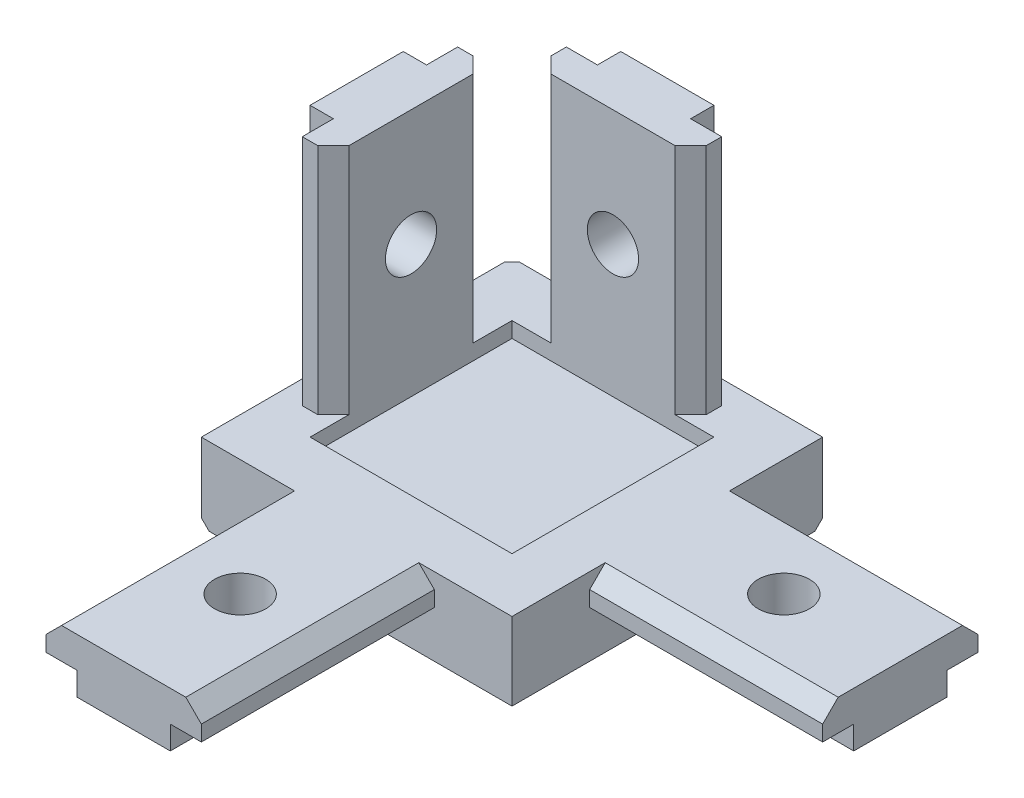
from build123d import *

# Parameters (mm, degrees)
SKETCH_1_W          = 20
SKETCH_1_H          = 20
EXTRUDE_1_DEPTH     = 5
EXTRUDE_3_DEPTH     = 15
EXTRUDE_4_DEPTH     = 15
EXTRUDE_5_DEPTH     = 15
SKETCH_9_W          = 13
SKETCH_9_H          = 13
CUT_EXTRUDE_4_DEPTH = 1
HOLE_WIZARD_M4_1_D  = 3.3
HOLE_WIZARD_M4_2_D  = 3.3
HOLE_WIZARD_M4_3_D  = 3.3
CHAMFER_1_SIZE      = 0.5


with BuildPart() as part:
    # 草图1 → 凸台-拉伸1 (new body)
    with BuildSketch(Plane(origin=(0, 0, 0), x_dir=(1, 0, 0), z_dir=(0, 1, 0))):
        Rectangle(SKETCH_1_W, SKETCH_1_H)
    extrude(amount=EXTRUDE_1_DEPTH)

    # 草图6 → 凸台-拉伸3 (add)
    with BuildSketch(Plane(origin=(10, 0, 0), x_dir=(0, 0, -1), z_dir=(1, 0, 0))):
        Polygon((-3, 1.5), (-3, 3), (-5, 3), (-5, 4), (-4, 5), (4, 5), (5, 4), (5, 3), (3, 3), (3, 1.5), align=None)
    extrude(amount=EXTRUDE_3_DEPTH)

    # 草图7 → 凸台-拉伸4 (add)
    with BuildSketch(Plane.XY.offset(10)):
        Polygon((-3, 1.5), (-3, 3), (-5, 3), (-5, 4), (-4, 5), (4, 5), (5, 4), (5, 3), (3, 3), (3, 1.5), align=None)
    extrude(amount=EXTRUDE_4_DEPTH)

    # 草图8 → 凸台-拉伸5 (add)
    with BuildSketch(Plane(origin=(0, 5, 0), x_dir=(1, 0, 0), z_dir=(0, 1, 0))):
        Polygon((-10, 3), (-8.5, 3), (-8.5, 5), (-7.5, 5), (-6.5, 4), (-6.5, -4), (-7.5, -5), (-8.5, -5), (-8.5, -3), (-10, -3), align=None)
        Polygon((3, 10), (-3, 10), (-3, 8.5), (-5, 8.5), (-5, 7.5), (-4, 6.5), (4, 6.5), (5, 7.5), (5, 8.5), (3, 8.5), align=None)
    extrude(amount=EXTRUDE_5_DEPTH)

    # 草图9 → 切除-拉伸4 (cut)
    with BuildSketch(Plane(origin=(0, 5, 0), x_dir=(1, 0, 0), z_dir=(0, 1, 0))):
        Rectangle(SKETCH_9_W, SKETCH_9_H)
    extrude(amount=-CUT_EXTRUDE_4_DEPTH, mode=Mode.SUBTRACT)

    # M4 螺纹孔1 (through all)
    with Locations(Plane(origin=(0, 5, 0), x_dir=(1, 0, 0), z_dir=(0, 1, 0))):
        with Locations((0, -17.5), (17.5, 0)):
            Hole(HOLE_WIZARD_M4_1_D / 2)

    # M4 螺纹孔2 (through all)
    with Locations(Plane.XY.offset(-6.5)):
        with Locations((0, 12.5)):
            Hole(HOLE_WIZARD_M4_2_D / 2)

    # M4 螺纹孔3 (through all)
    with Locations(Plane(origin=(-6.5, 0, 0), x_dir=(0, 0, -1), z_dir=(1, 0, 0))):
        with Locations((0, 12.5)):
            Hole(HOLE_WIZARD_M4_3_D / 2)

    # 倒角1
    chamfer_1_edges = [part.edges().sort_by_distance(p)[0] for p in [
        (-10, 0, 0),
        (0, 0, -10),
        (-10, 2.5, -10),
    ]]
    chamfer(chamfer_1_edges, length=CHAMFER_1_SIZE)


solid = part.part
